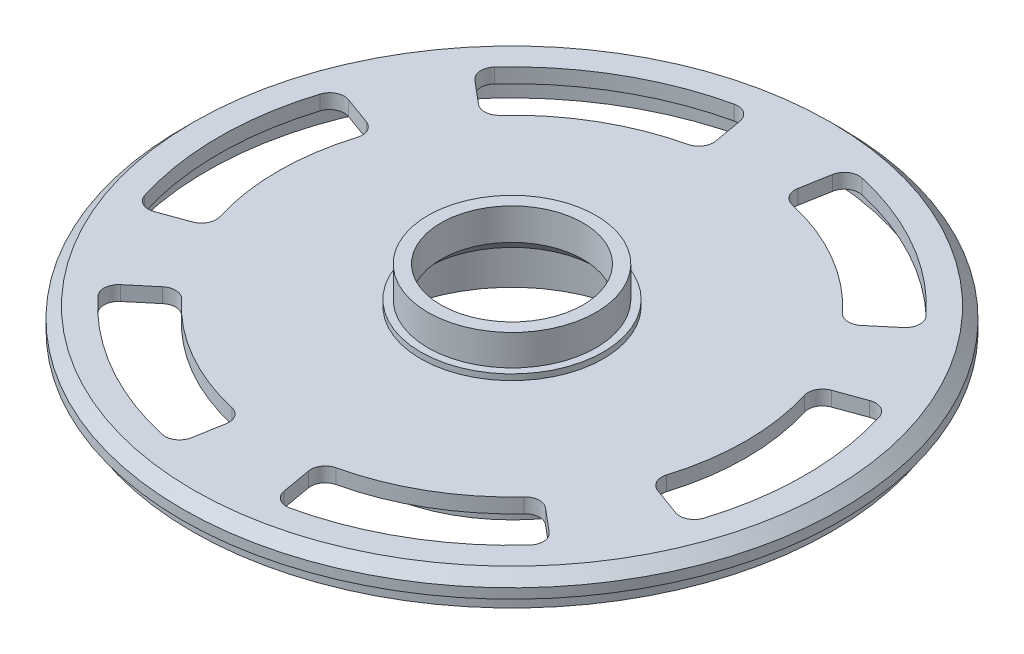
from build123d import *

# Parameters (mm, degrees)
CUT_EXTRUDE1_DEPTH      = 66.757280966
CIRPATTERN1_COUNT       = 6
CUT_EXTRUDE3_START      = 10.233026
SKETCH4_R               = 2.06
CUT_EXTRUDE3_DEPTH      = 76.990306966
CIRPATTERN2_COUNT       = 42
SKETCH5_R               = 28
SKETCH5_R_2             = 26
CUT_EXTRUDE_THIN1_DEPTH = 2.73302555


with BuildPart() as part:
    # Sketch1 → Revolve1 (revolve)
    with BuildSketch(Plane.XY, mode=Mode.PRIVATE) as revolve1_sk:
        Polygon((-45.1, 8.15), (-43.75, 8.15), (-43.75, 6.15), (-41.75, 6.15), (-41.75, 9), (-30.5, 9), (-29.5, 7.5), (-24.5, 7.5), (-23.5, 9), (-20.5, 9), (-20.5, 0.15), (-18.5, 0.15), (-18.5, 8.15), (-17.75, 8.15), (-17.75, 9.65), (-11.75336247, 9.65), (-9.73, 11.67336247), (-9.73, 16), (-11.5, 16), (-11.5, 11.8), (-12.5, 11.8), (-12.5, 11), (-43.6, 11), (-45.1, 9.5), align=None)
    revolve(revolve1_sk.sketch.rotate(Axis((0, 0, 0), (0, -1, 0)), 270), axis=Axis((0, 0, 0), (0, -1, 0)))

    # Sketch2 → Cut-Extrude1 (cut, symmetric)
    with BuildSketch(Plane(origin=(0, 0, 0), x_dir=(1, 0, 0), z_dir=(0, 1, 0))):
        with BuildLine():
            Line((35.669246782, 13.283267007), (31.812113332, 11.879385242))
            ThreePointArc((31.812113332, 11.879385242), (30.705470783, 10.8907609), (30.58461517, 9.411764706))
            ThreePointArc((30.58461517, 9.411764706), (32, 0), (30.58461517, -9.411764706))
            ThreePointArc((30.58461517, -9.411764706), (30.705470783, -10.8907609), (31.812113332, -11.879385242))
            Line((31.812113332, -11.879385242), (35.669246782, -13.283267007))
            ThreePointArc((35.669246782, -13.283267007), (37.239172304, -13.196981693), (38.261596101, -12.002510729))
            ThreePointArc((38.261596101, -12.002510729), (40.1, 0), (38.261596101, 12.002510729))
            ThreePointArc((38.261596101, 12.002510729), (37.239172304, 13.196981693), (35.669246782, 13.283267007))
        make_face()
    cut_extrude1 = extrude(amount=CUT_EXTRUDE1_DEPTH, both=True, mode=Mode.SUBTRACT)

    # CirPattern1: Cut-Extrude1 ×6 about axis
    cirpattern1_axis = Axis((0, 0, 0), (0, 1, 0))
    for i in range(1, CIRPATTERN1_COUNT):
        add(cut_extrude1.rotate(cirpattern1_axis, i * 360 / CIRPATTERN1_COUNT), mode=Mode.SUBTRACT)

    # Sketch4 → Cut-Extrude3 (cut, through all)
    with BuildSketch(Plane(origin=(0, 0, 0), x_dir=(1, 0, 0), z_dir=(0, 1, 0)).offset(CUT_EXTRUDE3_START)):
        with Locations(Location((27, 0, 0), (0, 0, 180))):
            Circle(SKETCH4_R)
    cut_extrude3 = extrude(amount=-CUT_EXTRUDE3_DEPTH, mode=Mode.SUBTRACT)

    # CirPattern2: Cut-Extrude3 ×42 about axis
    cirpattern2_axis = Axis((0, 0, 0), (0, 1, 0))
    for i in range(1, CIRPATTERN2_COUNT):
        add(cut_extrude3.rotate(cirpattern2_axis, i * 360 / CIRPATTERN2_COUNT), mode=Mode.SUBTRACT)

    # Sketch5 → Cut-Extrude-Thin1 (cut)
    with BuildSketch(Plane.XZ.offset(-7.5)):
        Circle(SKETCH5_R)
        Circle(SKETCH5_R_2, mode=Mode.SUBTRACT)
    extrude(amount=-CUT_EXTRUDE_THIN1_DEPTH, mode=Mode.SUBTRACT)


solid = part.part
